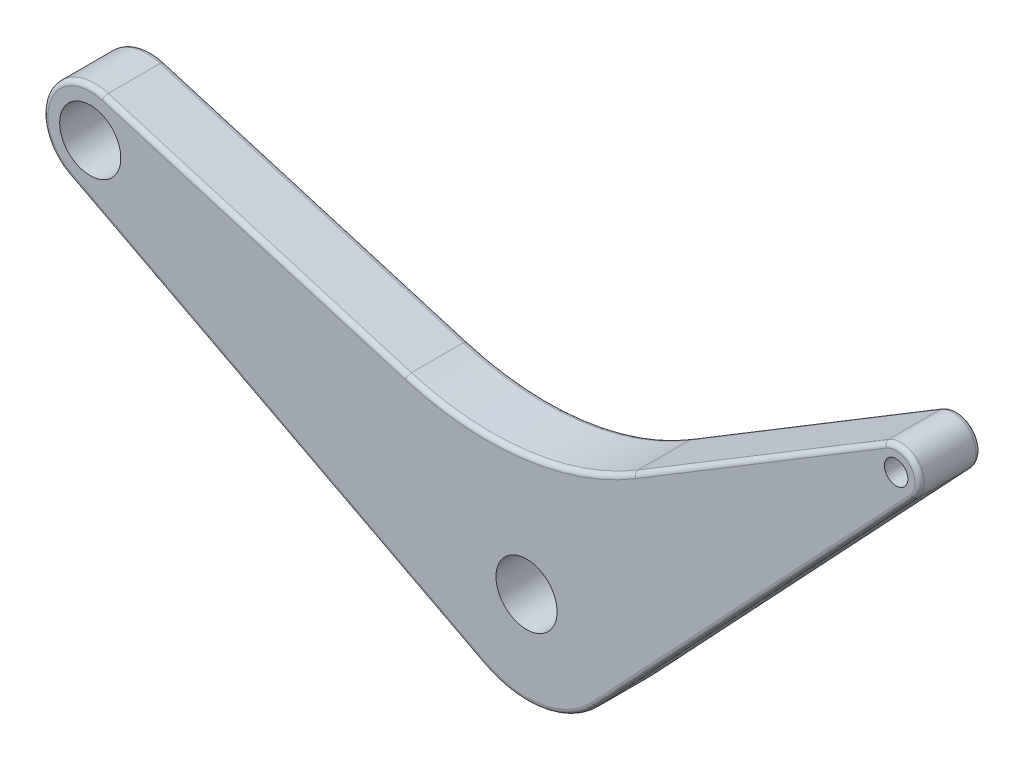
from build123d import *

# Parameters (mm, degrees)
SKETCH1_R           = 3.25
SKETCH1_R_2         = 1.25
BOSS_EXTRUDE1_DEPTH = 6.5
FILLET1_R           = 30
FILLET2_R           = 0.5
BOSS_EXTRUDE3_START = -1.5
SKETCH2_R           = 7.5
SKETCH2_R_2         = 3.25
BOSS_EXTRUDE3_DEPTH = 1.5
FILLET3_R           = 0.5
SCALE_1_SCALE       = 2


with BuildPart() as part:
    # Sketch1 → Boss-Extrude1 (new body)
    with BuildSketch(Plane.XY):
        with BuildLine():
            Line((-48.725428782, 14.171541553), (-4.630211955, -8.863472077))
            ThreePointArc((-4.630211955, -8.863472077), (1.667827944, -9.85993661), (7.287758219, -6.847523651))
            Line((7.287758219, -6.847523651), (41.138011945, 29.178998838))
            ThreePointArc((41.138011945, 29.178998838), (41.259114136, 32.463962322), (38.020883424, 33.029216848))
            Line((38.020883424, 33.029216848), (0, 10))
            Line((0, 10), (-44.983328095, 23.395321633))
            ThreePointArc((-44.983328095, 23.395321633), (-51.043541464, 20.482980986), (-48.725428782, 14.171541553))
        make_face()
        with Locations(Location((-46.410322805, 18.603277592, 0), (0, 0, 180))):
            Circle(SKETCH1_R, mode=Mode.SUBTRACT)
        with Locations(Location((39.31607239, 30.890879751, 0), (0, 0, 180))):
            Circle(SKETCH1_R_2, mode=Mode.SUBTRACT)
        with Locations(Location((0, 0, 0), (0, 0, 180))):
            Circle(SKETCH1_R, mode=Mode.SUBTRACT)
    extrude(amount=BOSS_EXTRUDE1_DEPTH)

    # Fillet1
    fillet1_edges = [part.edges().sort_by_distance(p)[0] for p in [
        (0, 10, 3.25),
    ]]
    fillet(fillet1_edges, radius=FILLET1_R)

    # Fillet2
    fillet2_edges = [part.edges().sort_by_distance(p)[0] for p in [
        (1.667827944, -9.85993661, 6.5),
        (24.212885082, 11.165737594, 6.5),
        (41.259114136, 32.463962322, 6.5),
        (24.69404334, 24.957161111, 6.5),
        (-28.860180348, 18.594103961, 0),
        (-28.860180348, 18.594103961, 6.5),
        (-0.3577879, 12.789001585, 0),
        (-0.3577879, 12.789001585, 6.5),
        (-51.043541464, 20.482980986, 6.5),
        (-26.677820368, 2.654034738, 6.5),
        (24.69404334, 24.957161111, 0),
        (41.259114136, 32.463962322, 0),
        (24.212885082, 11.165737594, 0),
        (1.667827944, -9.85993661, 0),
        (-26.677820368, 2.654034738, 0),
        (-51.043541464, 20.482980986, 0),
    ]]
    fillet(fillet2_edges, radius=FILLET2_R)

    # Sketch2 → Boss-Extrude3 (add)
    with BuildSketch(Plane.XY.offset(BOSS_EXTRUDE3_START)):
        Circle(SKETCH2_R)
        with Locations(Location((0, 0, 0), (0, 0, 180))):
            Circle(SKETCH2_R_2, mode=Mode.SUBTRACT)
    extrude(amount=BOSS_EXTRUDE3_DEPTH)

    # Fillet3
    fillet3_edges = [part.edges().sort_by_distance(p)[0] for p in [
        (-43.160322805, 18.603277592, 0),
        (40.56607239, 30.890879751, 0),
        (-7.5, 0, -1.5),
        (-7.5, 0, 0),
    ]]
    fillet(fillet3_edges, radius=FILLET3_R)


with BuildPart() as part_1:
    # 缩放比例1: scaled about (-4.273542233, 9.623468382, 3.154576374)
    add(part.part.scale(SCALE_1_SCALE).moved(Location((4.273542233, -9.623468382, -3.154576374))))


solid = part_1.part
